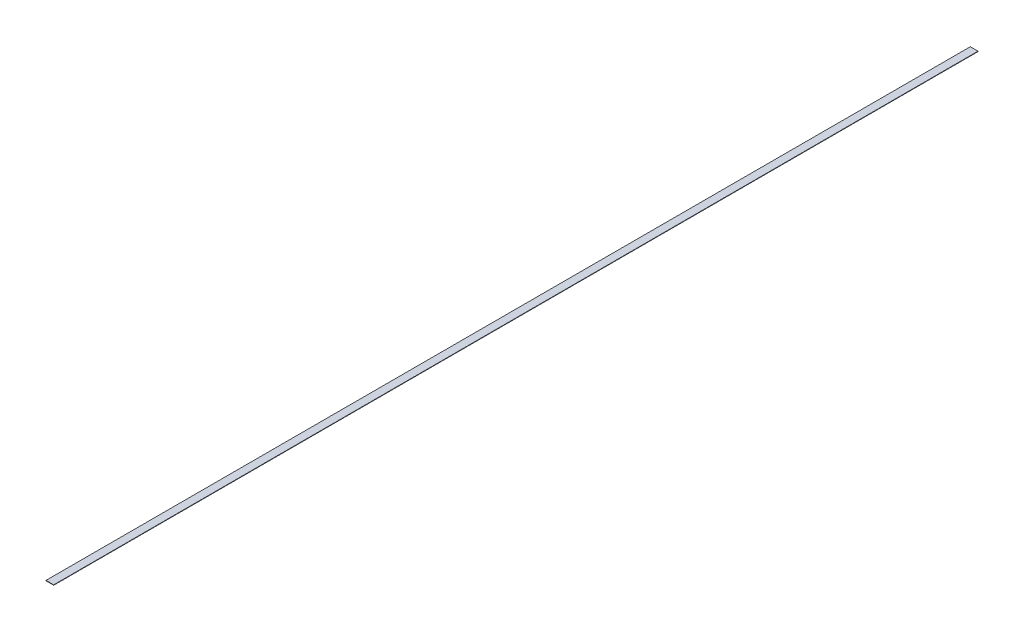
from build123d import *

# Parameters (mm, degrees)
SKETCH1_W           = 12.7
SKETCH1_H           = 0.6858
BOSS_EXTRUDE1_DEPTH = 1524


with BuildPart() as part:
    # Sketch1 → Boss-Extrude1 (new body)
    with BuildSketch(Plane.XY):
        with Locations((6511.426532627, 4619.671675753)):
            Rectangle(SKETCH1_W, SKETCH1_H)
    extrude(amount=BOSS_EXTRUDE1_DEPTH)


solid = part.part
